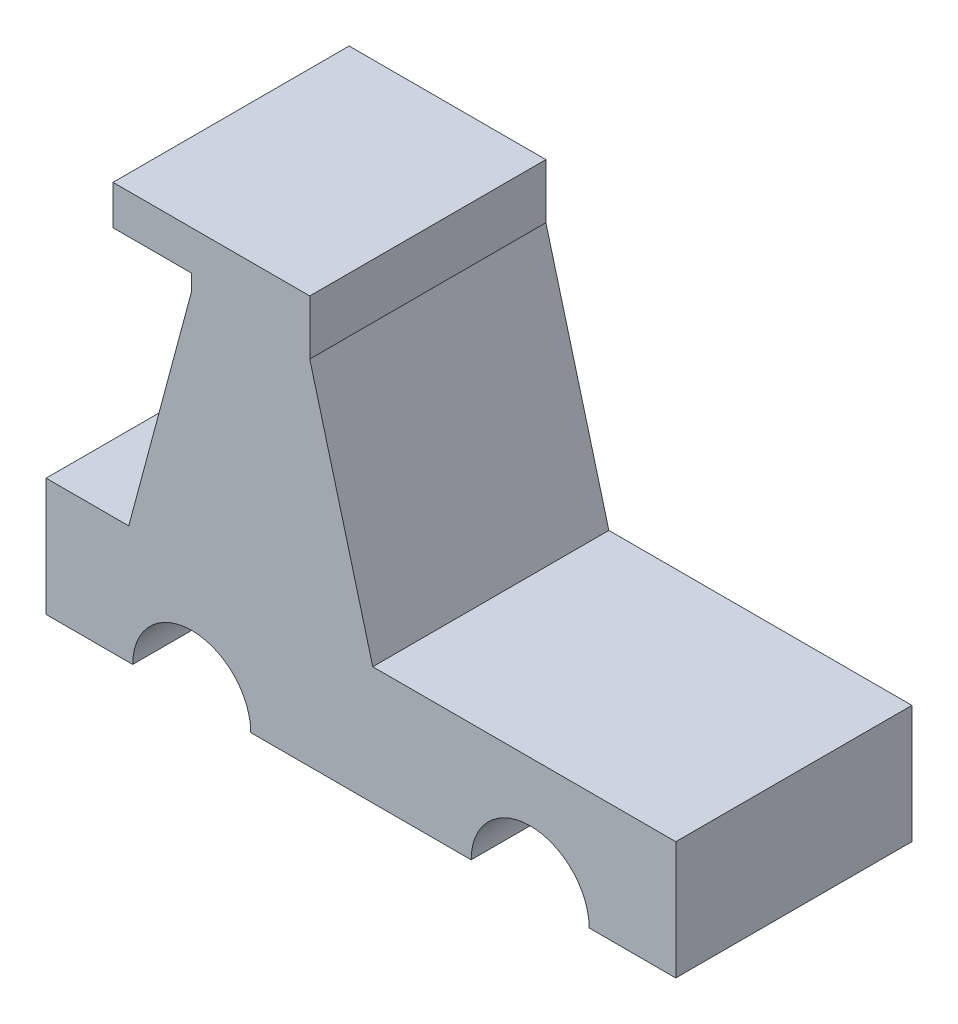
from build123d import *

# Parameters (mm, degrees)
SKETCH1_W               = 80
SKETCH1_H               = 30
BOSS_EXTRUDE1_DEPTH     = 30
CUT_EXTRUDE1_DEPTH      = 91.553851381
CUT_EXTRUDE1_DEPTH_BACK = 91.553851381
SKETCH2_R               = 7.5
BOSS_EXTRUDE2_DEPTH     = 30
CUT_EXTRUDE2_DEPTH      = 109.453861158
CUT_EXTRUDE2_DEPTH_BACK = 109.453861158
SKETCH4_W               = 102.556598927
SKETCH4_H               = 19.243482925


with BuildPart() as part:
    # Sketch1 → Boss-Extrude1 (new body)
    with BuildSketch(Plane(origin=(0, 0, 0), x_dir=(1, 0, 0), z_dir=(0, 1, 0))):
        with Locations((40, 15)):
            Rectangle(SKETCH1_W, SKETCH1_H)
    extrude(amount=BOSS_EXTRUDE1_DEPTH)

    # Sketch2 → Cut-Extrude1 (cut, two sides: drawn at the far end of the back side and taken through both)
    with BuildSketch(Plane.XY.offset(-CUT_EXTRUDE1_DEPTH_BACK)):
        with Locations((61.5, 15)):
            Circle(SKETCH2_R)
        with Locations(Location((18.5, 15, 0), (0, 0, 180))):
            Circle(SKETCH2_R)
    extrude(amount=CUT_EXTRUDE1_DEPTH + CUT_EXTRUDE1_DEPTH_BACK, mode=Mode.SUBTRACT)

    # Sketch3 → Boss-Extrude2 (add)
    with BuildSketch(Plane.XY):
        Polygon((18.5, 30), (18.5, 59.856406461), (10.5, 30), align=None)
        Polygon((8.5, 66.8), (8.5, 61.8), (18.5, 61.8), (18.5, 59.856406461), (18.5, 30), (41.5, 30), (33.5, 59.856406461), (33.5, 66.8), align=None)
    extrude(amount=-BOSS_EXTRUDE2_DEPTH)

    # Sketch4 → Cut-Extrude2 (cut, two sides: drawn at the far end of the back side and taken through both)
    with BuildSketch(Plane.XY.offset(-CUT_EXTRUDE2_DEPTH_BACK)):
        with Locations((41.179129622, 5.378258538)):
            Rectangle(SKETCH4_W, SKETCH4_H)
    extrude(amount=CUT_EXTRUDE2_DEPTH + CUT_EXTRUDE2_DEPTH_BACK, mode=Mode.SUBTRACT)


solid = part.part
